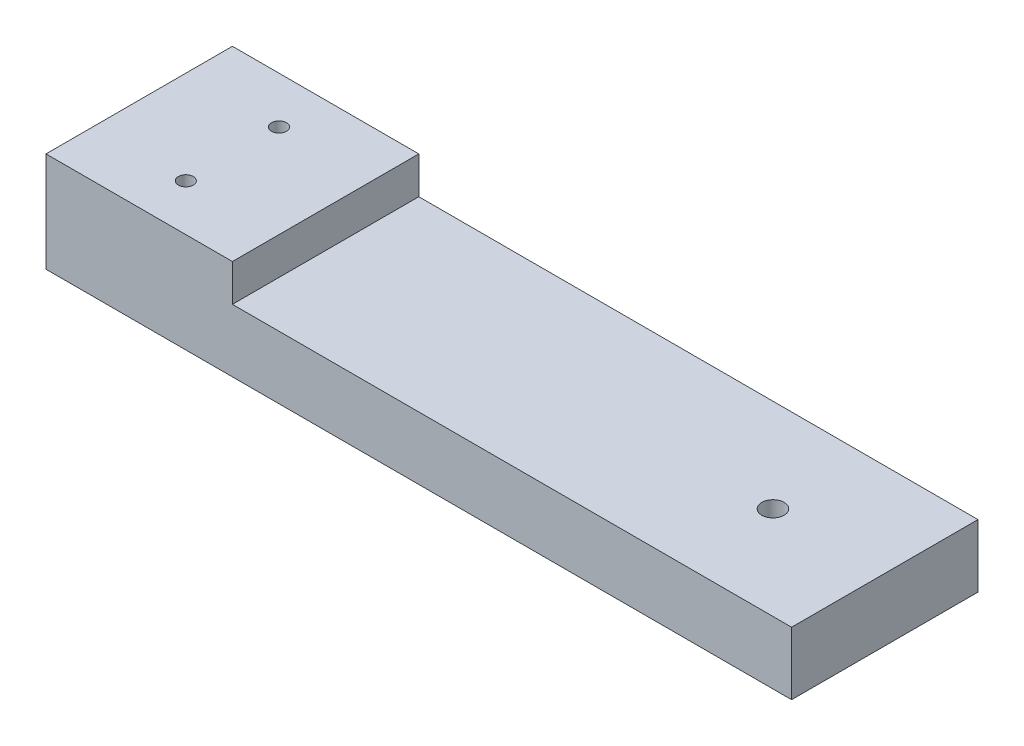
from build123d import *

# Parameters (mm, degrees)
SKETCH1_W           = 50
SKETCH1_H           = 50
BOSS_EXTRUDE1_DEPTH = 26.8
SKETCH1_3_W         = 150
SKETCH1_3_H         = 50
BOSS_EXTRUDE2_DEPTH = 16.85
SKETCH2_R           = 2
SKETCH2_R_2         = 3
CUT_EXTRUDE1_DEPTH  = 208.889970898


with BuildPart() as part:
    # Sketch1 → Boss-Extrude1 (new body)
    with BuildSketch(Plane(origin=(0, 0, 0), x_dir=(1, 0, 0), z_dir=(0, 1, 0))):
        with Locations((25, 25)):
            Rectangle(SKETCH1_W, SKETCH1_H)
    extrude(amount=BOSS_EXTRUDE1_DEPTH)

    # Sketch1<3> → Boss-Extrude2 (add)
    with BuildSketch(Plane(origin=(0, 0, 0), x_dir=(1, 0, 0), z_dir=(0, 1, 0))):
        with Locations((125, 25)):
            Rectangle(SKETCH1_3_W, SKETCH1_3_H)
    extrude(amount=BOSS_EXTRUDE2_DEPTH)

    # Sketch2 → Cut-Extrude1 (cut, through all)
    with BuildSketch(Plane.XZ):
        with Locations((25, -37.5)):
            Circle(SKETCH2_R)
        with Locations((25, -12.5)):
            Circle(SKETCH2_R)
        with Locations((170, -25)):
            Circle(SKETCH2_R_2)
    extrude(amount=-CUT_EXTRUDE1_DEPTH, mode=Mode.SUBTRACT)


solid = part.part
